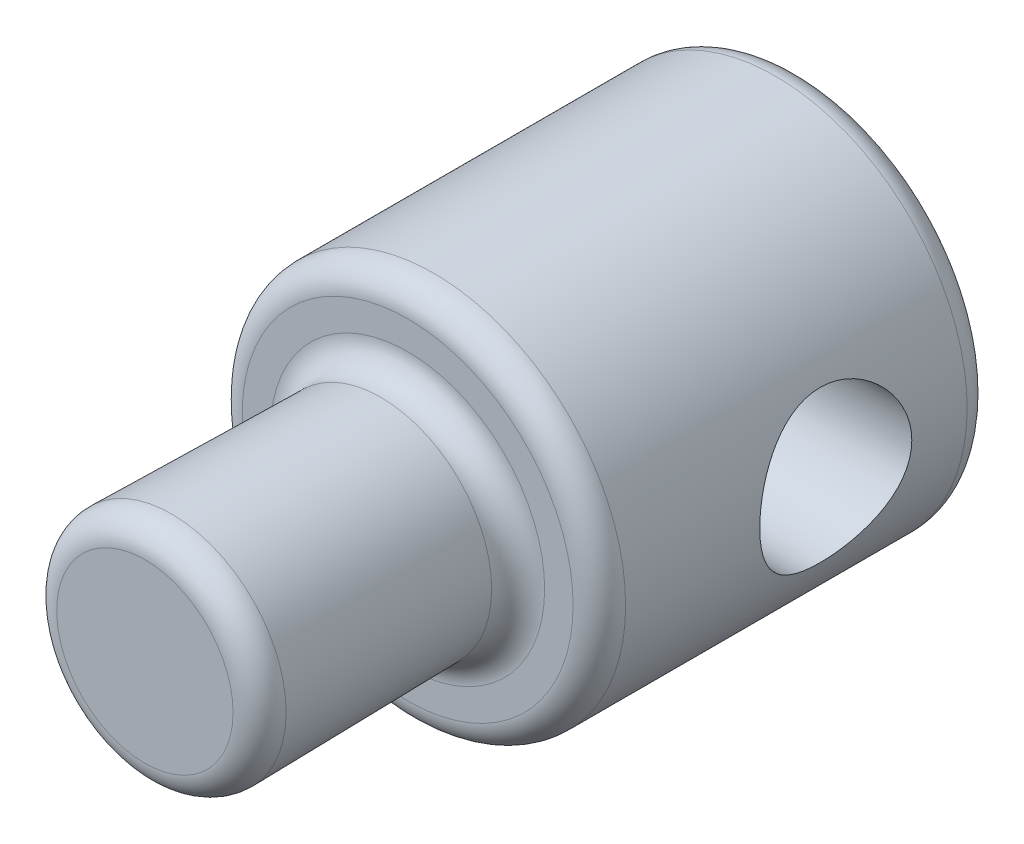
from build123d import *

# Parameters (mm, degrees)
ESQUISSE1_R             = 3.65
BOSS_EXTRU_1_DEPTH      = 7.5
ESQUISSE2_R             = 1.45
ENL_V_MAT_EXTRU_1_DEPTH = 7.2
ENL_V_MAT_EXTRU_1_DRAFT = -0.5
ESQUISSE3_R             = 2.1
BOSS_EXTRU_2_DEPTH      = 5
BOSS_EXTRU_2_DRAFT      = -1
CONG_2_R                = 0.5


with BuildPart() as part:
    # Esquisse1 → Boss.-Extru.1 (new body)
    with BuildSketch(Plane.XY):
        Circle(ESQUISSE1_R)
    extrude(amount=BOSS_EXTRU_1_DEPTH)


with BuildPart() as enl_v_mat_extru_1_tool:
    # Esquisse2 → Enlèv. mat.-Extru.1 (with draft: the straight prism first)
    with BuildSketch(Plane(origin=(4, 0, 0), x_dir=(0, 0, -1), z_dir=(1, 0, 0))):
        with Locations((-3, 0)):
            Circle(ESQUISSE2_R)
    extrude(amount=-ENL_V_MAT_EXTRU_1_DEPTH)
    # Enlèv. mat.-Extru.1: the draft: its side faces are tilted about the plane it starts from
    enl_v_mat_extru_1_sides = [enl_v_mat_extru_1_tool.faces().sort_by_distance(p)[0] for p in [
        (0.4, 0, 4.45),
    ]]
    draft(enl_v_mat_extru_1_sides, Plane(origin=(4, 0, 0), x_dir=(0, 0, -1), z_dir=(1, 0, 0)), ENL_V_MAT_EXTRU_1_DRAFT)


with BuildPart() as part_1:
    add(part.part)

    # Enlèv. mat.-Extru.1: cut by enl_v_mat_extru_1_tool
    add(enl_v_mat_extru_1_tool.part, mode=Mode.SUBTRACT)


with BuildPart() as boss_extru_2_tool:
    # Esquisse3 → Boss.-Extru.2 (with draft: the straight prism first)
    with BuildSketch(Plane.XY.offset(7.5)):
        Circle(ESQUISSE3_R)
    extrude(amount=BOSS_EXTRU_2_DEPTH)
    # Boss.-Extru.2: the draft: its side faces are tilted about the plane it starts from
    boss_extru_2_sides = [boss_extru_2_tool.faces().sort_by_distance(p)[0] for p in [
        (-2.1, 0, 10),
    ]]
    draft(boss_extru_2_sides, Plane.XY.offset(7.5), BOSS_EXTRU_2_DRAFT)


with BuildPart() as part_2:
    add(part_1.part)

    # Boss.-Extru.2: add boss_extru_2_tool
    add(boss_extru_2_tool.part)

    # Congé2
    cong_2_edges = [part_2.edges().sort_by_distance(p)[0] for p in [
        (-2.1, 0, 7.5),
        (-2.187275325, 0, 12.5),
        (-3.65, 0, 0),
        (-3.65, 0, 7.5),
    ]]
    fillet(cong_2_edges, radius=CONG_2_R)


solid = part_2.part
